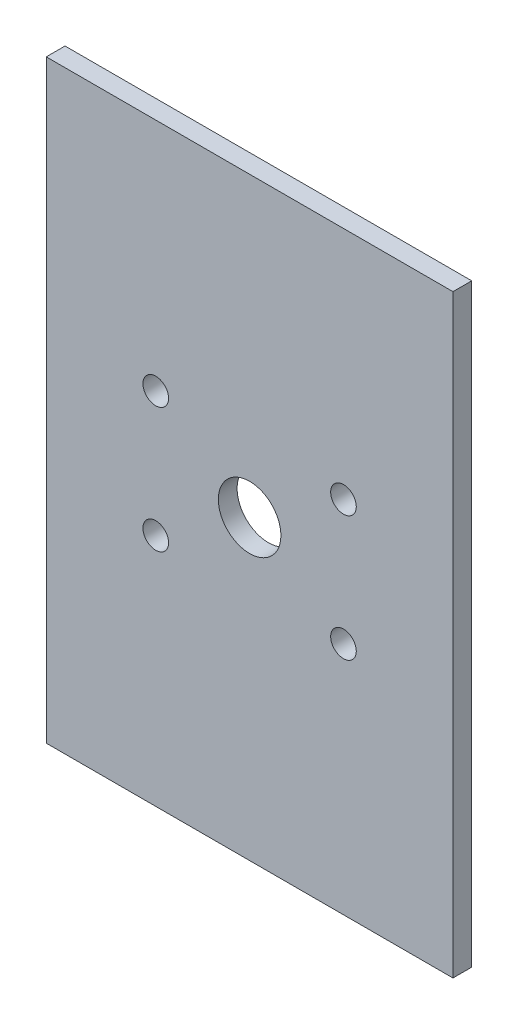
from build123d import *

# Parameters (mm, degrees)
SKETCH1_W                = 130
SKETCH1_H                = 190
BOSS_EXTRUDE1_DEPTH      = 6
CUT_EXTRUDE1_REACH       = 117.265
SKETCH2_R                = 10
M8_CLEARANCE_HOLE1_D     = 8.2
M8_CLEARANCE_HOLE1_DEPTH = 19.75
M8_CLEARANCE_HOLE1_TIP   = 2.463528538


with BuildPart() as part:
    # Sketch1 → Boss-Extrude1 (new body)
    with BuildSketch(Plane.XY):
        Rectangle(SKETCH1_W, SKETCH1_H)
    extrude(amount=BOSS_EXTRUDE1_DEPTH)

    # Sketch2 → Cut-Extrude1 (cut, up to next)
    with BuildSketch(Plane.XY.offset(6), mode=Mode.PRIVATE) as cut_extrude1_sk1:
        with Locations((-1.55e-07, 0)):
            Circle(SKETCH2_R)
    cut_extrude1_tool1 = extrude(cut_extrude1_sk1.sketch, amount=-CUT_EXTRUDE1_REACH, mode=Mode.PRIVATE) & part.part
    add(cut_extrude1_tool1.solids().sort_by_distance((0, 0, 6))[0], mode=Mode.SUBTRACT)

    # M8 Clearance Hole1
    with Locations(Plane(origin=(-30, 20, 6), x_dir=(1, 0, 0), z_dir=(0, 0, 1))):
        with Locations((0, 0), (60, 0), (60, -40), (0, -40)):
            Hole(M8_CLEARANCE_HOLE1_D / 2, depth=M8_CLEARANCE_HOLE1_DEPTH)
            with Locations((0, 0, -(M8_CLEARANCE_HOLE1_DEPTH + M8_CLEARANCE_HOLE1_TIP / 2))):  # 118° drill point
                Cone(0, M8_CLEARANCE_HOLE1_D / 2, M8_CLEARANCE_HOLE1_TIP, mode=Mode.SUBTRACT)


solid = part.part
